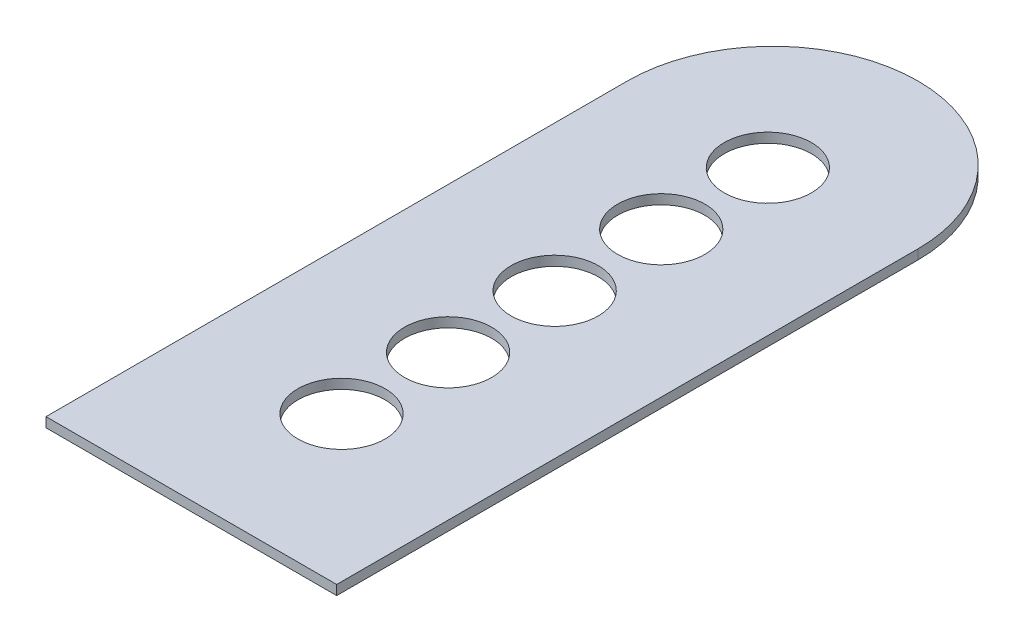
from build123d import *

# Parameters (mm, degrees)
ESQUISSE1_R        = 45
BOSS_EXTRU_1_DEPTH = 10


with BuildPart() as part:
    # Esquisse1 → Boss.-Extru.1 (new body)
    with BuildSketch(Plane(origin=(0, 0, 0), x_dir=(1, 0, 0), z_dir=(0, 1, 0))):
        with BuildLine():
            Line((0, 0), (0, 600))
            ThreePointArc((0, 600), (150, 750), (300, 600))
            Line((300, 600), (300, 0))
            Line((300, 0), (0, 0))
        make_face()
        with Locations(Location((150, 155, 0), (0, 0, 270))):
            Circle(ESQUISSE1_R, mode=Mode.SUBTRACT)
        with Locations(Location((150, 265, 0), (0, 0, 270))):
            Circle(ESQUISSE1_R, mode=Mode.SUBTRACT)
        with Locations(Location((150, 375, 0), (0, 0, 270))):
            Circle(ESQUISSE1_R, mode=Mode.SUBTRACT)
        with Locations(Location((150, 485, 0), (0, 0, 270))):
            Circle(ESQUISSE1_R, mode=Mode.SUBTRACT)
        with Locations(Location((150, 595, 0), (0, 0, 270))):
            Circle(ESQUISSE1_R, mode=Mode.SUBTRACT)
    extrude(amount=BOSS_EXTRU_1_DEPTH)


solid = part.part
